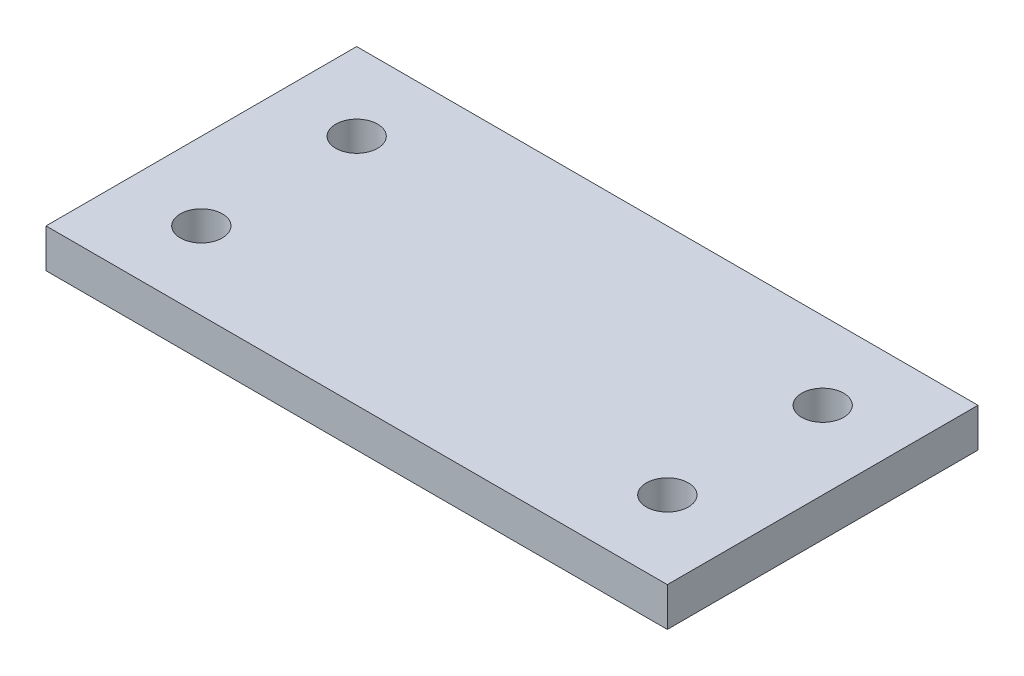
from build123d import *

# Parameters (mm, degrees)
SKETCH1_W           = 101.6
SKETCH1_H           = 50.8
BOSS_EXTRUDE1_DEPTH = 6.35
CUT_EXTRUDE2_REACH  = 59.15
SKETCH3_R           = 3.429


with BuildPart() as part:
    # Sketch1 → Boss-Extrude1 (new body)
    with BuildSketch(Plane(origin=(0, 0, 0), x_dir=(1, 0, 0), z_dir=(0, 1, 0))):
        Rectangle(SKETCH1_W, SKETCH1_H)
    extrude(amount=BOSS_EXTRUDE1_DEPTH)

    # Sketch3 → Cut-Extrude2 (cut, up to next)
    with BuildSketch(Plane.XZ, mode=Mode.PRIVATE) as cut_extrude2_sk1:
        with Locations(Location((-38.1, 12.7, 0), (0, 0, 270))):
            Circle(SKETCH3_R)
    cut_extrude2_tool1 = extrude(cut_extrude2_sk1.sketch, amount=-CUT_EXTRUDE2_REACH, mode=Mode.PRIVATE) & part.part
    # Sketch3 → Cut-Extrude2 (cut, up to next)
    with BuildSketch(Plane.XZ, mode=Mode.PRIVATE) as cut_extrude2_sk2:
        with Locations(Location((-38.1, -12.7, 0), (0, 0, 90))):
            Circle(SKETCH3_R)
    cut_extrude2_tool2 = extrude(cut_extrude2_sk2.sketch, amount=-CUT_EXTRUDE2_REACH, mode=Mode.PRIVATE) & part.part
    # Sketch3 → Cut-Extrude2 (cut, up to next)
    with BuildSketch(Plane.XZ, mode=Mode.PRIVATE) as cut_extrude2_sk3:
        with Locations(Location((38.1, 12.7, 0), (0, 0, 90))):
            Circle(SKETCH3_R)
    cut_extrude2_tool3 = extrude(cut_extrude2_sk3.sketch, amount=-CUT_EXTRUDE2_REACH, mode=Mode.PRIVATE) & part.part
    # Sketch3 → Cut-Extrude2 (cut, up to next)
    with BuildSketch(Plane.XZ, mode=Mode.PRIVATE) as cut_extrude2_sk4:
        with Locations(Location((38.1, -12.7, 0), (0, 0, 270))):
            Circle(SKETCH3_R)
    cut_extrude2_tool4 = extrude(cut_extrude2_sk4.sketch, amount=-CUT_EXTRUDE2_REACH, mode=Mode.PRIVATE) & part.part
    add(cut_extrude2_tool1.solids().sort_by_distance((-38.1, 0, 12.7))[0], mode=Mode.SUBTRACT)
    add(cut_extrude2_tool2.solids().sort_by_distance((-38.1, 0, -12.7))[0], mode=Mode.SUBTRACT)
    add(cut_extrude2_tool3.solids().sort_by_distance((38.1, 0, 12.7))[0], mode=Mode.SUBTRACT)
    add(cut_extrude2_tool4.solids().sort_by_distance((38.1, 0, -12.7))[0], mode=Mode.SUBTRACT)


solid = part.part
